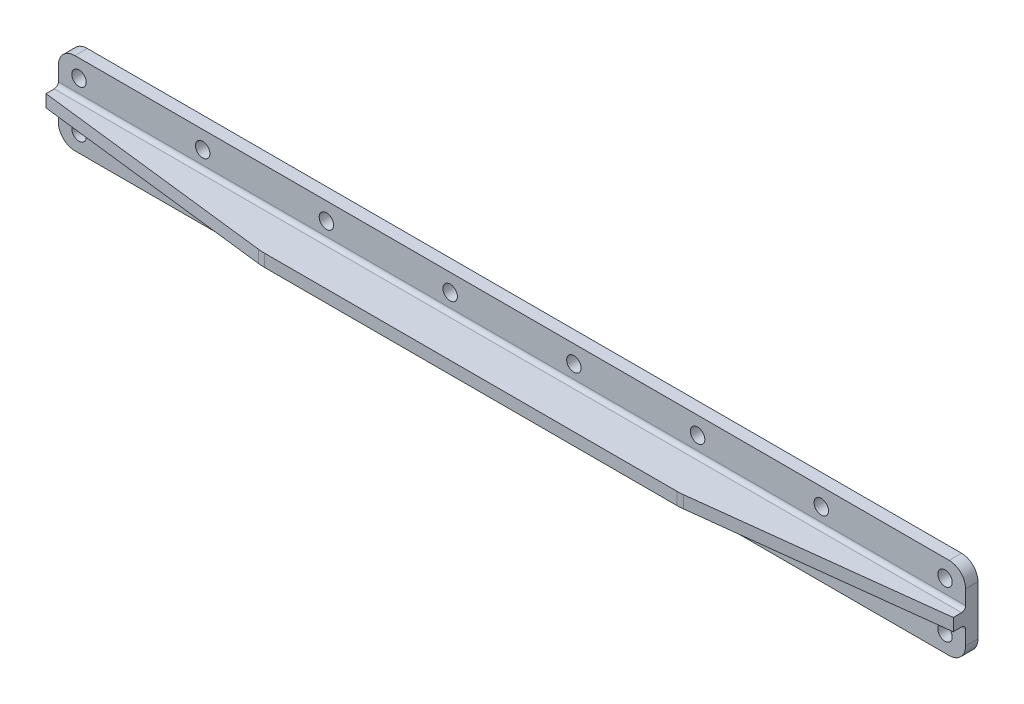
from build123d import *

# Parameters (mm, degrees)
BOSS_EXTRUDE1_DEPTH = 110
SKETCH2_R           = 1.75
CUT_EXTRUDE1_DEPTH  = 111.905365064
CUT_EXTRUDE2_DEPTH  = 112.360899781
FILLET1_R           = 4
FILLET2_R           = 1


with BuildPart() as part:
    # Sketch1 → Boss-Extrude1 (new, symmetric)
    with BuildSketch(Plane(origin=(0, 0, 0), x_dir=(0, 0, -1), z_dir=(1, 0, 0))):
        Polygon((-13, -1.5), (-13, 1.5), (-3, 1.5), (-3, 10), (0, 10), (0, -10), (-3, -10), (-3, -1.5), align=None)
    extrude(amount=BOSS_EXTRUDE1_DEPTH, both=True)

    # Sketch2 → Cut-Extrude1 (cut, through all)
    with BuildSketch(Plane.XY.offset(3)):
        with Locations((-15, -5.75)):
            Circle(SKETCH2_R)
        with Locations((-45, -5.75)):
            Circle(SKETCH2_R)
        with Locations((-75, -5.75)):
            Circle(SKETCH2_R)
        with Locations((-105, -5.75)):
            Circle(SKETCH2_R)
        with Locations(Location((105, -5.75, 0), (0, 0, 180))):
            Circle(SKETCH2_R)
        with Locations(Location((75, -5.75, 0), (0, 0, 180))):
            Circle(SKETCH2_R)
        with Locations(Location((45, -5.75, 0), (0, 0, 180))):
            Circle(SKETCH2_R)
        with Locations(Location((15, -5.75, 0), (0, 0, 180))):
            Circle(SKETCH2_R)
        with Locations((15, 5.75)):
            Circle(SKETCH2_R)
        with Locations((45, 5.75)):
            Circle(SKETCH2_R)
        with Locations((75, 5.75)):
            Circle(SKETCH2_R)
        with Locations((105, 5.75)):
            Circle(SKETCH2_R)
        with Locations(Location((-105, 5.75, 0), (0, 0, 180))):
            Circle(SKETCH2_R)
        with Locations(Location((-75, 5.75, 0), (0, 0, 180))):
            Circle(SKETCH2_R)
        with Locations(Location((-45, 5.75, 0), (0, 0, 180))):
            Circle(SKETCH2_R)
        with Locations(Location((-15, 5.75, 0), (0, 0, 180))):
            Circle(SKETCH2_R)
    extrude(amount=-CUT_EXTRUDE1_DEPTH, mode=Mode.SUBTRACT)

    # Sketch3 → Cut-Extrude2 (cut, through all)
    with BuildSketch(Plane(origin=(0, 1.5, 0), x_dir=(1, 0, 0), z_dir=(0, 1, 0))):
        with BuildLine():
            Line((50, -13), (110, -13))
            Line((110, -13), (110, -6))
            Line((110, -6), (51.525650044, -12.910166224))
            ThreePointArc((51.525650044, -12.910166224), (50.764146283, -12.977522123), (50, -13))
        make_face()
        with BuildLine():
            Line((-51.525650044, -12.910166224), (-110, -6))
            Line((-110, -6), (-110, -13))
            Line((-110, -13), (-50, -13))
            ThreePointArc((-50, -13), (-50.764146283, -12.977522123), (-51.525650044, -12.910166224))
        make_face()
    extrude(amount=-CUT_EXTRUDE2_DEPTH, mode=Mode.SUBTRACT)

    # Fillet1
    fillet1_edges = [part.edges().sort_by_distance(p)[0] for p in [
        (110, -10, 1.5),
        (110, 10, 1.5),
        (-110, 10, 1.5),
        (-110, -10, 1.5),
    ]]
    fillet(fillet1_edges, radius=FILLET1_R)

    # Fillet2
    fillet2_edges = [part.edges().sort_by_distance(p)[0] for p in [
        (0, -1.5, 3),
        (0, 1.5, 3),
    ]]
    fillet(fillet2_edges, radius=FILLET2_R)


solid = part.part
